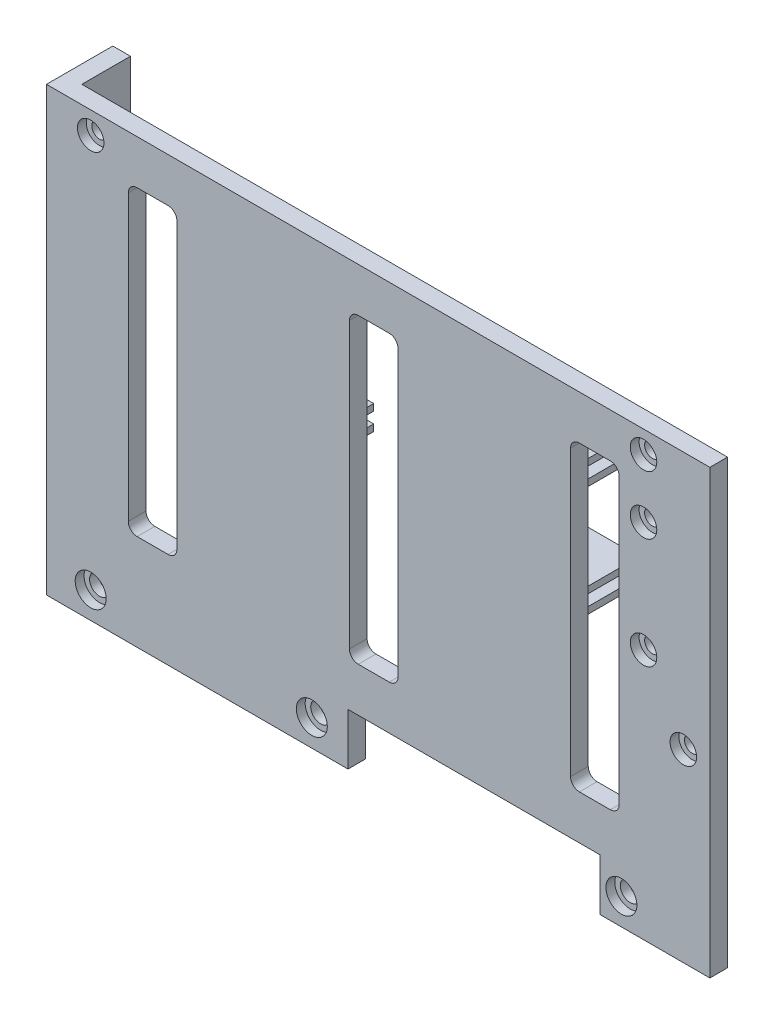
from build123d import *

# Parameters (mm, degrees)
SKETCH1_W                 = 150
SKETCH1_H                 = 4
BOSS_EXTRUDE1_DEPTH       = 100
CUT_EXTRUDE1_REACH        = 127.064
SKETCH7_W                 = 57
SKETCH7_H                 = 11.694235649
SKETCH9_W                 = 4
SKETCH9_H                 = 100
BOSS_EXTRUDE4_DEPTH       = 11
SKETCH10_W                = 20
SKETCH10_H                = 1.5
BOSS_EXTRUDE5_DEPTH       = 15
LPATTERN1_COUNT           = 2
LPATTERN1_PITCH           = 60
LPATTERN2_COUNT           = 2
LPATTERN2_PITCH           = 25
LPATTERN2_COPY_1_SKETCH_W = 20
LPATTERN2_COPY_1_SKETCH_H = 1.5
LPATTERN2_COPY_1_DEPTH    = 15
LPATTERN3_COUNT           = 2
LPATTERN3_PITCH           = 4
LPATTERN3_COPY_1_SKETCH_W = 20
LPATTERN3_COPY_1_SKETCH_H = 1.5
LPATTERN3_COPY_1_DEPTH    = 15
LPATTERN3_COPY_2_SKETCH_W = 20
LPATTERN3_COPY_2_SKETCH_H = 1.5
LPATTERN3_COPY_2_DEPTH    = 15
LPATTERN3_COPY_3_SKETCH_W = 20
LPATTERN3_COPY_3_SKETCH_H = 1.5
LPATTERN3_COPY_3_DEPTH    = 15
SKETCH12_R                = 3.5
CUT_EXTRUDE2_DEPTH        = 2
CUT_EXTRUDE3_REACH        = 128.151
SKETCH13_R                = 2.25
LPATTERN4_COUNT           = 2
LPATTERN4_PITCH           = 50
SKETCH15_R                = 3
CUT_EXTRUDE4_DEPTH        = 2
CUT_EXTRUDE5_REACH        = 219.319
SKETCH17_R                = 1.75
LPATTERN5_COUNT           = 2
LPATTERN5_PITCH           = 25
SKETCH18_W                = 10
SKETCH18_H                = 7
CUT_EXTRUDE6_DEPTH        = 3
LPATTERN6_COUNT           = 2
LPATTERN6_PITCH           = 55
CUT_EXTRUDE7_REACH        = 127.897
SKETCH19_W                = 11
SKETCH19_H                = 68.305764351
FILLET1_R                 = 2
LPATTERN7_COUNT           = 3
LPATTERN7_PITCH           = 50
FILLET1_OF_LPATTERN7_R    = 2
LPATTERN8_COUNT           = 2
LPATTERN8_PITCH           = 120
SKETCH20_W                = 8
SKETCH20_H                = 10
CUT_EXTRUDE8_DEPTH        = 3
LPATTERN9_COUNT           = 2
LPATTERN9_PITCH           = 60
SKETCH22_R                = 3
CUT_EXTRUDE9_DEPTH        = 2
CUT_EXTRUDE10_REACH       = 217.691
SKETCH24_R                = 1.75
SKETCH26_R                = 3
CUT_EXTRUDE11_DEPTH       = 2
CUT_EXTRUDE12_REACH       = 123.185
SKETCH28_R                = 1.75
LPATTERN11_COUNT          = 2
LPATTERN11_PITCH          = 125


with BuildPart() as part:
    # Sketch1 → Boss-Extrude1 (new body)
    with BuildSketch(Plane(origin=(0, 0, 0), x_dir=(1, 0, 0), z_dir=(0, 1, 0))):
        with Locations((0, -58)):
            Rectangle(SKETCH1_W, SKETCH1_H)
    extrude(amount=BOSS_EXTRUDE1_DEPTH)

    # Sketch7 → Cut-Extrude1 (cut, up to next)
    with BuildSketch(Plane.XY.offset(60), mode=Mode.PRIVATE) as cut_extrude1_sk1:
        with Locations((21.68, 5.847117825)):
            Rectangle(SKETCH7_W, SKETCH7_H)
    cut_extrude1_tool1 = extrude(cut_extrude1_sk1.sketch, amount=-CUT_EXTRUDE1_REACH, mode=Mode.PRIVATE) & part.part
    add(cut_extrude1_tool1.solids().sort_by_distance((21.68, 5.847118, 60))[0], mode=Mode.SUBTRACT)

    # Sketch9 → Boss-Extrude4 (add)
    with BuildSketch(Plane(origin=(0, 0, 56), x_dir=(-1, 0, 0), z_dir=(0, 0, -1))):
        with Locations((73, 50)):
            Rectangle(SKETCH9_W, SKETCH9_H)
    extrude(amount=BOSS_EXTRUDE4_DEPTH)

    # Sketch10 → Boss-Extrude5 (add)
    with BuildSketch(Plane(origin=(0, 0, 56), x_dir=(-1, 0, 0), z_dir=(0, 0, -1))):
        with Locations((-30, 50.75)):
            Rectangle(SKETCH10_W, SKETCH10_H)
    boss_extrude5 = extrude(amount=BOSS_EXTRUDE5_DEPTH)

    # LPattern1: Boss-Extrude5 ×2
    with Locations(*[(-i * LPATTERN1_PITCH, 0, 0) for i in range(1, LPATTERN1_COUNT)]):
        add(boss_extrude5)

    # LPattern2: Boss-Extrude5 ×2
    with Locations(*[(0, i * LPATTERN2_PITCH, 0) for i in range(1, LPATTERN2_COUNT)]):
        add(boss_extrude5)

    # LPattern2 copy 1 sketch → LPattern2 copy 1 (add)
    with BuildSketch(Plane(origin=(-60, 25, 56), x_dir=(-1, 0, 0), z_dir=(0, 0, -1))):
        with Locations((-30, 50.75)):
            Rectangle(LPATTERN2_COPY_1_SKETCH_W, LPATTERN2_COPY_1_SKETCH_H)
    extrude(amount=LPATTERN2_COPY_1_DEPTH)

    # LPattern3: Boss-Extrude5 ×2
    with Locations(*[(0, i * LPATTERN3_PITCH, 0) for i in range(1, LPATTERN3_COUNT)]):
        add(boss_extrude5)

    # LPattern3 copy 1 sketch → LPattern3 copy 1 (add)
    with BuildSketch(Plane(origin=(-60, 4, 56), x_dir=(-1, 0, 0), z_dir=(0, 0, -1))):
        with Locations((-30, 50.75)):
            Rectangle(LPATTERN3_COPY_1_SKETCH_W, LPATTERN3_COPY_1_SKETCH_H)
    extrude(amount=LPATTERN3_COPY_1_DEPTH)

    # LPattern3 copy 2 sketch → LPattern3 copy 2 (add)
    with BuildSketch(Plane(origin=(0, 29, 56), x_dir=(-1, 0, 0), z_dir=(0, 0, -1))):
        with Locations((-30, 50.75)):
            Rectangle(LPATTERN3_COPY_2_SKETCH_W, LPATTERN3_COPY_2_SKETCH_H)
    extrude(amount=LPATTERN3_COPY_2_DEPTH)

    # LPattern3 copy 3 sketch → LPattern3 copy 3 (add)
    with BuildSketch(Plane(origin=(-60, 29, 56), x_dir=(-1, 0, 0), z_dir=(0, 0, -1))):
        with Locations((-30, 50.75)):
            Rectangle(LPATTERN3_COPY_3_SKETCH_W, LPATTERN3_COPY_3_SKETCH_H)
    extrude(amount=LPATTERN3_COPY_3_DEPTH)

    # Sketch12 → Cut-Extrude2 (cut)
    with BuildSketch(Plane.XY.offset(60)):
        with Locations((-65, 6)):
            Circle(SKETCH12_R)
    cut_extrude2 = extrude(amount=-CUT_EXTRUDE2_DEPTH, mode=Mode.SUBTRACT)

    # Sketch13 → Cut-Extrude3 (cut, up to next)
    with BuildSketch(Plane.XY.offset(58), mode=Mode.PRIVATE) as cut_extrude3_sk1:
        with Locations((-65, 6)):
            Circle(SKETCH13_R)
    cut_extrude3_tool1 = extrude(cut_extrude3_sk1.sketch, amount=-CUT_EXTRUDE3_REACH, mode=Mode.PRIVATE) & part.part
    cut_extrude3 = cut_extrude3_tool1.solids().sort_by_distance((-65, 6, 58))[0]
    add(cut_extrude3, mode=Mode.SUBTRACT)

    # LPattern4: Cut-Extrude2, Cut-Extrude3 ×2
    with Locations(*[(i * LPATTERN4_PITCH, 0, 0) for i in range(1, LPATTERN4_COUNT)]):
        add(cut_extrude2, mode=Mode.SUBTRACT)
        add(cut_extrude3, mode=Mode.SUBTRACT)

    # Sketch15 → Cut-Extrude4 (cut)
    with BuildSketch(Plane(origin=(125.77806455, 81.403570161, 60), x_dir=(1, 0, 0), z_dir=(0, 0, 1))):
        with Locations((-65.77806455, 0.346429839)):
            Circle(SKETCH15_R)
    cut_extrude4 = extrude(amount=-CUT_EXTRUDE4_DEPTH, mode=Mode.SUBTRACT)

    # Sketch17 → Cut-Extrude5 (cut, up to next)
    with BuildSketch(Plane(origin=(125.77806455, 81.403570161, 58), x_dir=(1, 0, 0), z_dir=(0, 0, 1)), mode=Mode.PRIVATE) as cut_extrude5_sk1:
        with Locations((-65.77806455, 0.346429839)):
            Circle(SKETCH17_R)
    cut_extrude5_tool1 = extrude(cut_extrude5_sk1.sketch, amount=-CUT_EXTRUDE5_REACH, mode=Mode.PRIVATE) & part.part
    cut_extrude5 = cut_extrude5_tool1.solids().sort_by_distance((60, 81.75, 58))[0]
    add(cut_extrude5, mode=Mode.SUBTRACT)

    # LPattern5: Cut-Extrude4, Cut-Extrude5 ×2
    with Locations(*[(0, -i * LPATTERN5_PITCH, 0) for i in range(1, LPATTERN5_COUNT)]):
        add(cut_extrude4, mode=Mode.SUBTRACT)
        add(cut_extrude5, mode=Mode.SUBTRACT)

    # Sketch18 → Cut-Extrude6 (cut)
    with BuildSketch(Plane(origin=(0, 0, 56), x_dir=(-1, 0, 0), z_dir=(0, 0, -1))):
        with Locations((-67.5, 86.5)):
            Rectangle(SKETCH18_W, SKETCH18_H)
    cut_extrude6 = extrude(amount=-CUT_EXTRUDE6_DEPTH, mode=Mode.SUBTRACT)

    # LPattern6: Cut-Extrude6 ×2
    with Locations(*[(0, -i * LPATTERN6_PITCH, 0) for i in range(1, LPATTERN6_COUNT)]):
        add(cut_extrude6, mode=Mode.SUBTRACT)

    # Sketch19 → Cut-Extrude7 (cut, up to next)
    with BuildSketch(Plane(origin=(0, 0, 56), x_dir=(-1, 0, 0), z_dir=(0, 0, -1)), mode=Mode.PRIVATE) as cut_extrude7_sk1:
        with Locations((-49, 55.847117825)):
            Rectangle(SKETCH19_W, SKETCH19_H)
    cut_extrude7_tool1 = extrude(cut_extrude7_sk1.sketch, amount=-CUT_EXTRUDE7_REACH, mode=Mode.PRIVATE) & part.part
    cut_extrude7 = cut_extrude7_tool1.solids().sort_by_distance((49, 55.847118, 56))[0]
    add(cut_extrude7, mode=Mode.SUBTRACT)

    # Fillet1
    fillet1_edges = [part.edges().sort_by_distance(p)[0] for p in [
        (54.5, 21.694235649, 58),
        (54.5, 90, 58),
        (43.5, 90, 58),
        (43.5, 21.694235649, 58),
    ]]
    fillet(fillet1_edges, radius=FILLET1_R)

    # LPattern7: Cut-Extrude7 ×3
    with Locations(*[(-i * LPATTERN7_PITCH, 0, 0) for i in range(1, LPATTERN7_COUNT)]):
        add(cut_extrude7, mode=Mode.SUBTRACT)

    # Fillet1 of LPattern7
    fillet1_of_lpattern7_edges = [part.edges().sort_by_distance(p)[0] for p in [
        (4.5, 21.694235649, 58),
        (4.5, 90, 58),
        (-6.5, 90, 58),
        (-6.5, 21.694235649, 58),
        (-45.5, 21.694235649, 58),
        (-45.5, 90, 58),
        (-56.5, 90, 58),
        (-56.5, 21.694235649, 58),
    ]]
    fillet(fillet1_of_lpattern7_edges, radius=FILLET1_OF_LPATTERN7_R)

    # LPattern8: Cut-Extrude2, Cut-Extrude3 ×2
    with Locations(*[(i * LPATTERN8_PITCH, 0, 0) for i in range(1, LPATTERN8_COUNT)]):
        add(cut_extrude2, mode=Mode.SUBTRACT)
        add(cut_extrude3, mode=Mode.SUBTRACT)

    # Sketch20 → Cut-Extrude8 (cut)
    with BuildSketch(Plane(origin=(0, 0, 56), x_dir=(-1, 0, 0), z_dir=(0, 0, -1))):
        with Locations((-29, 89.134967696)):
            Rectangle(SKETCH20_W, SKETCH20_H)
    cut_extrude8 = extrude(amount=-CUT_EXTRUDE8_DEPTH, mode=Mode.SUBTRACT)

    # LPattern9: Cut-Extrude8 ×2
    with Locations(*[(-i * LPATTERN9_PITCH, 0, 0) for i in range(1, LPATTERN9_COUNT)]):
        add(cut_extrude8, mode=Mode.SUBTRACT)

    # Sketch22 → Cut-Extrude9 (cut)
    with BuildSketch(Plane(origin=(131.167270466, 38.938204498, 60), x_dir=(1, 0, 0), z_dir=(0, 0, 1))):
        with Locations((-62.167270466, 2.811795502)):
            Circle(SKETCH22_R)
    extrude(amount=-CUT_EXTRUDE9_DEPTH, mode=Mode.SUBTRACT)

    # Sketch24 → Cut-Extrude10 (cut, up to next)
    with BuildSketch(Plane(origin=(131.167270466, 38.938204498, 58), x_dir=(1, 0, 0), z_dir=(0, 0, 1)), mode=Mode.PRIVATE) as cut_extrude10_sk1:
        with Locations((-62.167270466, 2.811795502)):
            Circle(SKETCH24_R)
    cut_extrude10_tool1 = extrude(cut_extrude10_sk1.sketch, amount=-CUT_EXTRUDE10_REACH, mode=Mode.PRIVATE) & part.part
    add(cut_extrude10_tool1.solids().sort_by_distance((69, 41.75, 58))[0], mode=Mode.SUBTRACT)

    # Sketch26 → Cut-Extrude11 (cut)
    with BuildSketch(Plane(origin=(-1.555186457, 92.391705768, 60), x_dir=(1, 0, 0), z_dir=(0, 0, 1))):
        with Locations((-63.444813543, 2.608294232)):
            Circle(SKETCH26_R)
    cut_extrude11 = extrude(amount=-CUT_EXTRUDE11_DEPTH, mode=Mode.SUBTRACT)

    # Sketch28 → Cut-Extrude12 (cut, up to next)
    with BuildSketch(Plane(origin=(-1.555186457, 92.391705768, 58), x_dir=(1, 0, 0), z_dir=(0, 0, 1)), mode=Mode.PRIVATE) as cut_extrude12_sk1:
        with Locations((-63.444813543, 2.608294232)):
            Circle(SKETCH28_R)
    cut_extrude12_tool1 = extrude(cut_extrude12_sk1.sketch, amount=-CUT_EXTRUDE12_REACH, mode=Mode.PRIVATE) & part.part
    cut_extrude12 = cut_extrude12_tool1.solids().sort_by_distance((-65, 95, 58))[0]
    add(cut_extrude12, mode=Mode.SUBTRACT)

    # LPattern11: Cut-Extrude11, Cut-Extrude12 ×2
    with Locations(*[(i * LPATTERN11_PITCH, 0, 0) for i in range(1, LPATTERN11_COUNT)]):
        add(cut_extrude11, mode=Mode.SUBTRACT)
        add(cut_extrude12, mode=Mode.SUBTRACT)


solid = part.part
